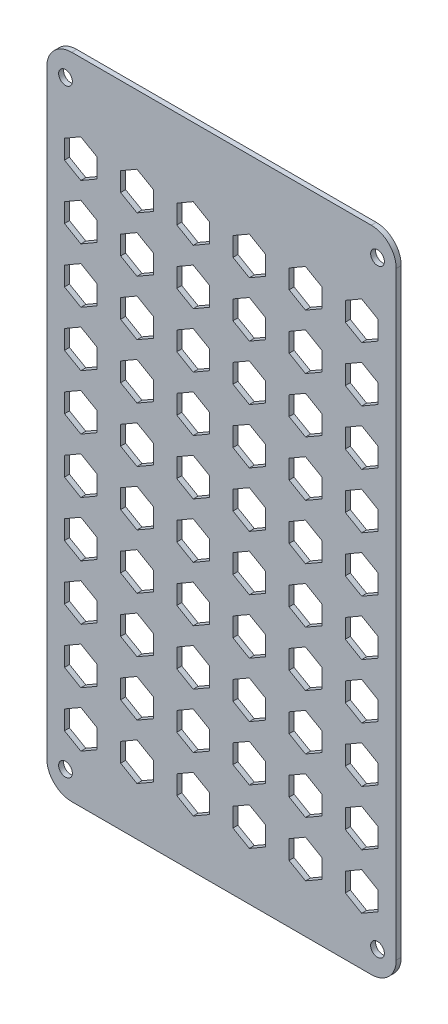
from build123d import *

# Parameters (mm, degrees)
SKETCH1_W            = 140
SKETCH1_H            = 260
BOSS_EXTRUDE1_DEPTH  = 2
M5_CLEARANCE_HOLE1_D = 5.5
FILLET1_R            = 10
CUT_EXTRUDE1_DEPTH   = 2


with BuildPart() as part:
    # Sketch1 → Boss-Extrude1 (new body)
    with BuildSketch(Plane.XY):
        Rectangle(SKETCH1_W, SKETCH1_H)
    extrude(amount=BOSS_EXTRUDE1_DEPTH)

    # M5 Clearance Hole1 (through all)
    with Locations(Plane(origin=(-62.5, 120, 2), x_dir=(1, 0, 0), z_dir=(0, 0, 1))):
        with Locations((0, 0), (125, 0), (125, -240), (0, -240)):
            Hole(M5_CLEARANCE_HOLE1_D / 2)

    # Fillet1
    fillet1_edges = [part.edges().sort_by_distance(p)[0] for p in [
        (-70, 130, 1),
        (70, 130, 1),
        (70, -130, 1),
        (-70, -130, 1),
    ]]
    fillet(fillet1_edges, radius=FILLET1_R)

    # Sketch4 → Cut-Extrude1 (cut)
    with BuildSketch(Plane.XY.offset(2)):
        Polygon((-33.852693342, 102.502301314), (-40.414415141, 98.713889467), (-40.414415141, 91.137065774), (-33.852693342, 87.348653928), (-27.290971544, 91.137065774), (-27.290971544, 98.713889467), align=None)
        Polygon((-56.352693342, 102.502301314), (-62.914415141, 98.713889467), (-62.914415141, 91.137065774), (-56.352693342, 87.348653928), (-49.790971544, 91.137065774), (-49.790971544, 98.713889467), align=None)
        Polygon((-11.352693342, 102.502301314), (-17.914415141, 98.713889467), (-17.914415141, 91.137065774), (-11.352693342, 87.348653928), (-4.790971544, 91.137065774), (-4.790971544, 98.713889467), align=None)
        Polygon((11.147306658, 102.502301314), (4.585584859, 98.713889467), (4.585584859, 91.137065774), (11.147306658, 87.348653928), (17.709028456, 91.137065774), (17.709028456, 98.713889467), align=None)
        Polygon((33.647306658, 102.502301314), (27.085584859, 98.713889467), (27.085584859, 91.137065774), (33.647306658, 87.348653928), (40.209028456, 91.137065774), (40.209028456, 98.713889467), align=None)
        Polygon((56.147306658, 102.502301314), (49.585584859, 98.713889467), (49.585584859, 91.137065774), (56.147306658, 87.348653928), (62.709028456, 91.137065774), (62.709028456, 98.713889467), align=None)
        Polygon((-33.852693342, 80.502301314), (-40.414415141, 76.713889467), (-40.414415141, 69.137065774), (-33.852693342, 65.348653928), (-27.290971544, 69.137065774), (-27.290971544, 76.713889467), align=None)
        Polygon((-11.352693342, 80.502301314), (-17.914415141, 76.713889467), (-17.914415141, 69.137065774), (-11.352693342, 65.348653928), (-4.790971544, 69.137065774), (-4.790971544, 76.713889467), align=None)
        Polygon((11.147306658, 80.502301314), (4.585584859, 76.713889467), (4.585584859, 69.137065774), (11.147306658, 65.348653928), (17.709028456, 69.137065774), (17.709028456, 76.713889467), align=None)
        Polygon((33.647306658, 80.502301314), (27.085584859, 76.713889467), (27.085584859, 69.137065774), (33.647306658, 65.348653928), (40.209028456, 69.137065774), (40.209028456, 76.713889467), align=None)
        Polygon((56.147306658, 80.502301314), (49.585584859, 76.713889467), (49.585584859, 69.137065774), (56.147306658, 65.348653928), (62.709028456, 69.137065774), (62.709028456, 76.713889467), align=None)
        Polygon((-33.852693342, 58.502301314), (-40.414415141, 54.713889467), (-40.414415141, 47.137065774), (-33.852693342, 43.348653928), (-27.290971544, 47.137065774), (-27.290971544, 54.713889467), align=None)
        Polygon((-11.352693342, 58.502301314), (-17.914415141, 54.713889467), (-17.914415141, 47.137065774), (-11.352693342, 43.348653928), (-4.790971544, 47.137065774), (-4.790971544, 54.713889467), align=None)
        Polygon((11.147306658, 58.502301314), (4.585584859, 54.713889467), (4.585584859, 47.137065774), (11.147306658, 43.348653928), (17.709028456, 47.137065774), (17.709028456, 54.713889467), align=None)
        Polygon((33.647306658, 58.502301314), (27.085584859, 54.713889467), (27.085584859, 47.137065774), (33.647306658, 43.348653928), (40.209028456, 47.137065774), (40.209028456, 54.713889467), align=None)
        Polygon((56.147306658, 58.502301314), (49.585584859, 54.713889467), (49.585584859, 47.137065774), (56.147306658, 43.348653928), (62.709028456, 47.137065774), (62.709028456, 54.713889467), align=None)
        Polygon((-33.852693342, 36.502301314), (-40.414415141, 32.713889467), (-40.414415141, 25.137065774), (-33.852693342, 21.348653928), (-27.290971544, 25.137065774), (-27.290971544, 32.713889467), align=None)
        Polygon((-11.352693342, 36.502301314), (-17.914415141, 32.713889467), (-17.914415141, 25.137065774), (-11.352693342, 21.348653928), (-4.790971544, 25.137065774), (-4.790971544, 32.713889467), align=None)
        Polygon((11.147306658, 36.502301314), (4.585584859, 32.713889467), (4.585584859, 25.137065774), (11.147306658, 21.348653928), (17.709028456, 25.137065774), (17.709028456, 32.713889467), align=None)
        Polygon((33.647306658, 36.502301314), (27.085584859, 32.713889467), (27.085584859, 25.137065774), (33.647306658, 21.348653928), (40.209028456, 25.137065774), (40.209028456, 32.713889467), align=None)
        Polygon((56.147306658, 36.502301314), (49.585584859, 32.713889467), (49.585584859, 25.137065774), (56.147306658, 21.348653928), (62.709028456, 25.137065774), (62.709028456, 32.713889467), align=None)
        Polygon((-33.852693342, 14.502301314), (-40.414415141, 10.713889467), (-40.414415141, 3.137065774), (-33.852693342, -0.651346072), (-27.290971544, 3.137065774), (-27.290971544, 10.713889467), align=None)
        Polygon((-11.352693342, 14.502301314), (-17.914415141, 10.713889467), (-17.914415141, 3.137065774), (-11.352693342, -0.651346072), (-4.790971544, 3.137065774), (-4.790971544, 10.713889467), align=None)
        Polygon((11.147306658, 14.502301314), (4.585584859, 10.713889467), (4.585584859, 3.137065774), (11.147306658, -0.651346072), (17.709028456, 3.137065774), (17.709028456, 10.713889467), align=None)
        Polygon((33.647306658, 14.502301314), (27.085584859, 10.713889467), (27.085584859, 3.137065774), (33.647306658, -0.651346072), (40.209028456, 3.137065774), (40.209028456, 10.713889467), align=None)
        Polygon((56.147306658, 14.502301314), (49.585584859, 10.713889467), (49.585584859, 3.137065774), (56.147306658, -0.651346072), (62.709028456, 3.137065774), (62.709028456, 10.713889467), align=None)
        Polygon((-33.852693342, -7.497698686), (-40.414415141, -11.286110533), (-40.414415141, -18.862934226), (-33.852693342, -22.651346072), (-27.290971544, -18.862934226), (-27.290971544, -11.286110533), align=None)
        Polygon((-11.352693342, -7.497698686), (-17.914415141, -11.286110533), (-17.914415141, -18.862934226), (-11.352693342, -22.651346072), (-4.790971544, -18.862934226), (-4.790971544, -11.286110533), align=None)
        Polygon((11.147306658, -7.497698686), (4.585584859, -11.286110533), (4.585584859, -18.862934226), (11.147306658, -22.651346072), (17.709028456, -18.862934226), (17.709028456, -11.286110533), align=None)
        Polygon((33.647306658, -7.497698686), (27.085584859, -11.286110533), (27.085584859, -18.862934226), (33.647306658, -22.651346072), (40.209028456, -18.862934226), (40.209028456, -11.286110533), align=None)
        Polygon((56.147306658, -7.497698686), (49.585584859, -11.286110533), (49.585584859, -18.862934226), (56.147306658, -22.651346072), (62.709028456, -18.862934226), (62.709028456, -11.286110533), align=None)
        Polygon((-33.852693342, -29.497698686), (-40.414415141, -33.286110533), (-40.414415141, -40.862934226), (-33.852693342, -44.651346072), (-27.290971544, -40.862934226), (-27.290971544, -33.286110533), align=None)
        Polygon((-11.352693342, -29.497698686), (-17.914415141, -33.286110533), (-17.914415141, -40.862934226), (-11.352693342, -44.651346072), (-4.790971544, -40.862934226), (-4.790971544, -33.286110533), align=None)
        Polygon((11.147306658, -29.497698686), (4.585584859, -33.286110533), (4.585584859, -40.862934226), (11.147306658, -44.651346072), (17.709028456, -40.862934226), (17.709028456, -33.286110533), align=None)
        Polygon((33.647306658, -29.497698686), (27.085584859, -33.286110533), (27.085584859, -40.862934226), (33.647306658, -44.651346072), (40.209028456, -40.862934226), (40.209028456, -33.286110533), align=None)
        Polygon((56.147306658, -29.497698686), (49.585584859, -33.286110533), (49.585584859, -40.862934226), (56.147306658, -44.651346072), (62.709028456, -40.862934226), (62.709028456, -33.286110533), align=None)
        Polygon((-33.852693342, -51.497698686), (-40.414415141, -55.286110533), (-40.414415141, -62.862934226), (-33.852693342, -66.651346072), (-27.290971544, -62.862934226), (-27.290971544, -55.286110533), align=None)
        Polygon((-11.352693342, -51.497698686), (-17.914415141, -55.286110533), (-17.914415141, -62.862934226), (-11.352693342, -66.651346072), (-4.790971544, -62.862934226), (-4.790971544, -55.286110533), align=None)
        Polygon((11.147306658, -51.497698686), (4.585584859, -55.286110533), (4.585584859, -62.862934226), (11.147306658, -66.651346072), (17.709028456, -62.862934226), (17.709028456, -55.286110533), align=None)
        Polygon((33.647306658, -51.497698686), (27.085584859, -55.286110533), (27.085584859, -62.862934226), (33.647306658, -66.651346072), (40.209028456, -62.862934226), (40.209028456, -55.286110533), align=None)
        Polygon((56.147306658, -51.497698686), (49.585584859, -55.286110533), (49.585584859, -62.862934226), (56.147306658, -66.651346072), (62.709028456, -62.862934226), (62.709028456, -55.286110533), align=None)
        Polygon((-33.852693342, -73.497698686), (-40.414415141, -77.286110533), (-40.414415141, -84.862934226), (-33.852693342, -88.651346072), (-27.290971544, -84.862934226), (-27.290971544, -77.286110533), align=None)
        Polygon((-11.352693342, -73.497698686), (-17.914415141, -77.286110533), (-17.914415141, -84.862934226), (-11.352693342, -88.651346072), (-4.790971544, -84.862934226), (-4.790971544, -77.286110533), align=None)
        Polygon((11.147306658, -73.497698686), (4.585584859, -77.286110533), (4.585584859, -84.862934226), (11.147306658, -88.651346072), (17.709028456, -84.862934226), (17.709028456, -77.286110533), align=None)
        Polygon((33.647306658, -73.497698686), (27.085584859, -77.286110533), (27.085584859, -84.862934226), (33.647306658, -88.651346072), (40.209028456, -84.862934226), (40.209028456, -77.286110533), align=None)
        Polygon((56.147306658, -73.497698686), (49.585584859, -77.286110533), (49.585584859, -84.862934226), (56.147306658, -88.651346072), (62.709028456, -84.862934226), (62.709028456, -77.286110533), align=None)
        Polygon((-33.852693342, -95.497698686), (-40.414415141, -99.286110533), (-40.414415141, -106.862934226), (-33.852693342, -110.651346072), (-27.290971544, -106.862934226), (-27.290971544, -99.286110533), align=None)
        Polygon((-11.352693342, -95.497698686), (-17.914415141, -99.286110533), (-17.914415141, -106.862934226), (-11.352693342, -110.651346072), (-4.790971544, -106.862934226), (-4.790971544, -99.286110533), align=None)
        Polygon((11.147306658, -95.497698686), (4.585584859, -99.286110533), (4.585584859, -106.862934226), (11.147306658, -110.651346072), (17.709028456, -106.862934226), (17.709028456, -99.286110533), align=None)
        Polygon((33.647306658, -95.497698686), (27.085584859, -99.286110533), (27.085584859, -106.862934226), (33.647306658, -110.651346072), (40.209028456, -106.862934226), (40.209028456, -99.286110533), align=None)
        Polygon((56.147306658, -95.497698686), (49.585584859, -99.286110533), (49.585584859, -106.862934226), (56.147306658, -110.651346072), (62.709028456, -106.862934226), (62.709028456, -99.286110533), align=None)
        Polygon((-56.352693342, 80.502301314), (-62.914415141, 76.713889467), (-62.914415141, 69.137065774), (-56.352693342, 65.348653928), (-49.790971544, 69.137065774), (-49.790971544, 76.713889467), align=None)
        Polygon((-56.352693342, 58.502301314), (-62.914415141, 54.713889467), (-62.914415141, 47.137065774), (-56.352693342, 43.348653928), (-49.790971544, 47.137065774), (-49.790971544, 54.713889467), align=None)
        Polygon((-56.352693342, 36.502301314), (-62.914415141, 32.713889467), (-62.914415141, 25.137065774), (-56.352693342, 21.348653928), (-49.790971544, 25.137065774), (-49.790971544, 32.713889467), align=None)
        Polygon((-56.352693342, 14.502301314), (-62.914415141, 10.713889467), (-62.914415141, 3.137065774), (-56.352693342, -0.651346072), (-49.790971544, 3.137065774), (-49.790971544, 10.713889467), align=None)
        Polygon((-56.352693342, -7.497698686), (-62.914415141, -11.286110533), (-62.914415141, -18.862934226), (-56.352693342, -22.651346072), (-49.790971544, -18.862934226), (-49.790971544, -11.286110533), align=None)
        Polygon((-56.352693342, -29.497698686), (-62.914415141, -33.286110533), (-62.914415141, -40.862934226), (-56.352693342, -44.651346072), (-49.790971544, -40.862934226), (-49.790971544, -33.286110533), align=None)
        Polygon((-56.352693342, -51.497698686), (-62.914415141, -55.286110533), (-62.914415141, -62.862934226), (-56.352693342, -66.651346072), (-49.790971544, -62.862934226), (-49.790971544, -55.286110533), align=None)
        Polygon((-56.352693342, -73.497698686), (-62.914415141, -77.286110533), (-62.914415141, -84.862934226), (-56.352693342, -88.651346072), (-49.790971544, -84.862934226), (-49.790971544, -77.286110533), align=None)
        Polygon((-56.352693342, -95.497698686), (-62.914415141, -99.286110533), (-62.914415141, -106.862934226), (-56.352693342, -110.651346072), (-49.790971544, -106.862934226), (-49.790971544, -99.286110533), align=None)
    extrude(amount=-CUT_EXTRUDE1_DEPTH, mode=Mode.SUBTRACT)


solid = part.part
